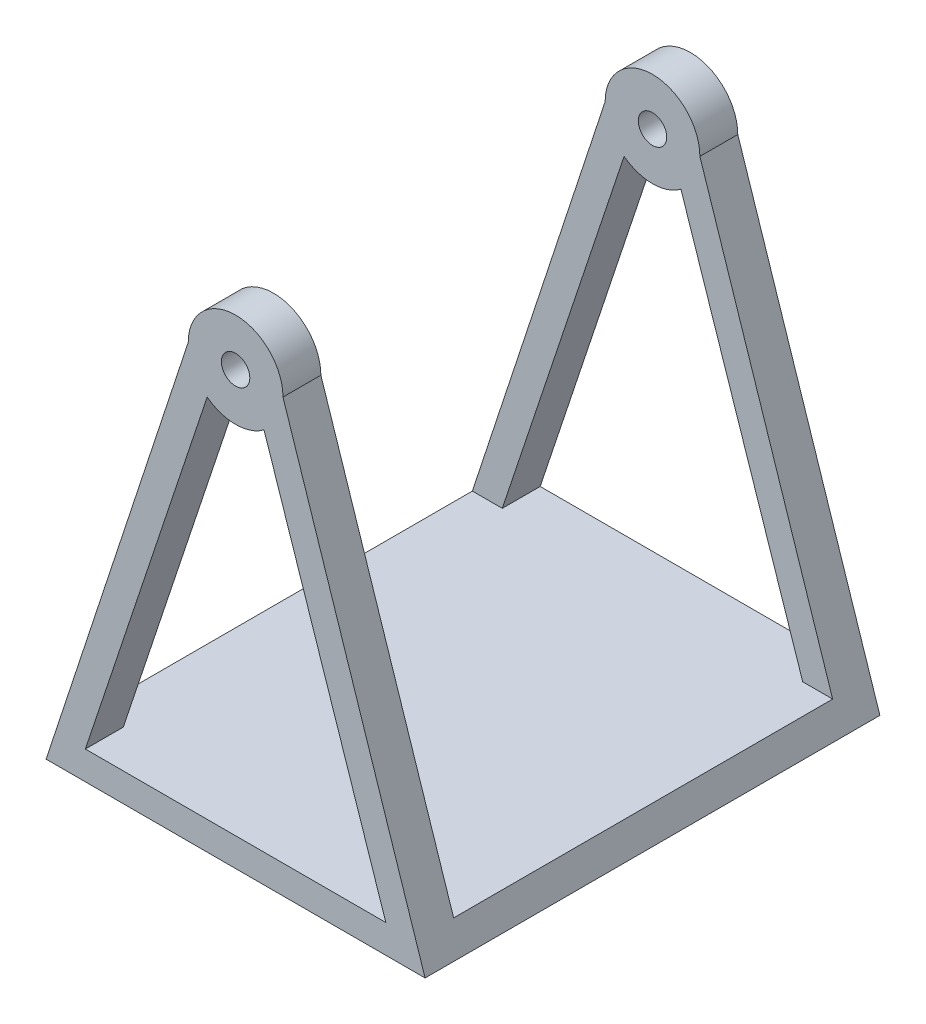
from build123d import *

# Parameters (mm, degrees)
SKETCH1_R           = 125
SKETCH1_R_2         = 37.5
BOSS_EXTRUDE1_DEPTH = 100
BOSS_EXTRUDE3_DEPTH = 500


with BuildPart() as part:
    # Sketch1 → Boss-Extrude1 (new body)
    # profile 1 of 2: a face of its own
    with BuildSketch(Plane.XY):
        with BuildLine():
            ThreePointArc((-75, -100), (-111.803398875, -55.901699437), (-125, 0))
            Line((-125, 0), (-500, -1139.901311518))
            Line((-500, -1139.901311518), (500, -1139.901311518))
            Line((500, -1139.901311518), (125, 0))
            ThreePointArc((125, 0), (111.803398875, -55.901699437), (75, -100))
            Line((75, -100), (396.372608044, -1064.901311518))
            Line((396.372608044, -1064.901311518), (-396.372608044, -1064.901311518))
            Line((-396.372608044, -1064.901311518), (-75, -100))
        make_face()
    # profile 2 of 2: a face of its own
    with BuildSketch(Plane.XY):
        Circle(SKETCH1_R)
        Circle(SKETCH1_R_2, mode=Mode.SUBTRACT)
    extrude(amount=BOSS_EXTRUDE1_DEPTH)

    # Sketch3 → Boss-Extrude3 (add)
    with BuildSketch(Plane.XY.offset(100)):
        Polygon((-500, -1139.901311518), (-475.326811439, -1064.901311518), (475.326811439, -1064.901311518), (500, -1139.901311518), align=None)
    extrude(amount=BOSS_EXTRUDE3_DEPTH)

    # Mirror2: part across plane


with BuildPart() as part_1:
    add(part.part)
    add(part.part.mirror(Plane.XY.offset(600)))


solid = part_1.part
